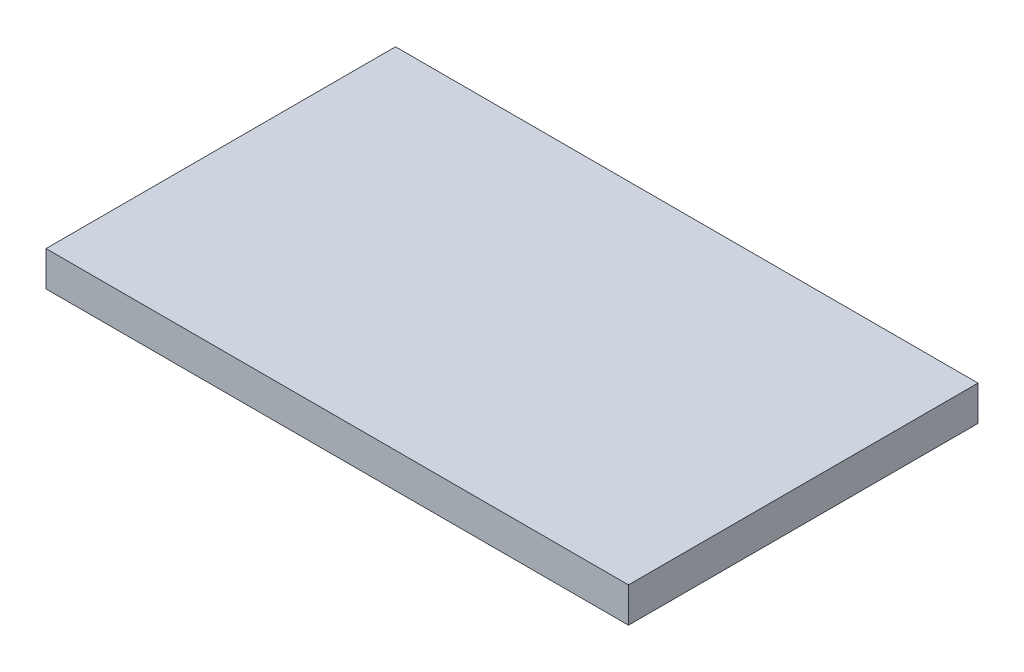
from build123d import *

# Parameters (mm, degrees)
SKETCH1_W           = 500
SKETCH1_H           = 300
BOSS_EXTRUDE1_DEPTH = 30


with BuildPart() as part:
    # Sketch1 → Boss-Extrude1 (new body)
    with BuildSketch(Plane(origin=(0, 0, 0), x_dir=(1, 0, 0), z_dir=(0, 1, 0))):
        Rectangle(SKETCH1_W, SKETCH1_H)
    extrude(amount=-BOSS_EXTRUDE1_DEPTH)


solid = part.part
